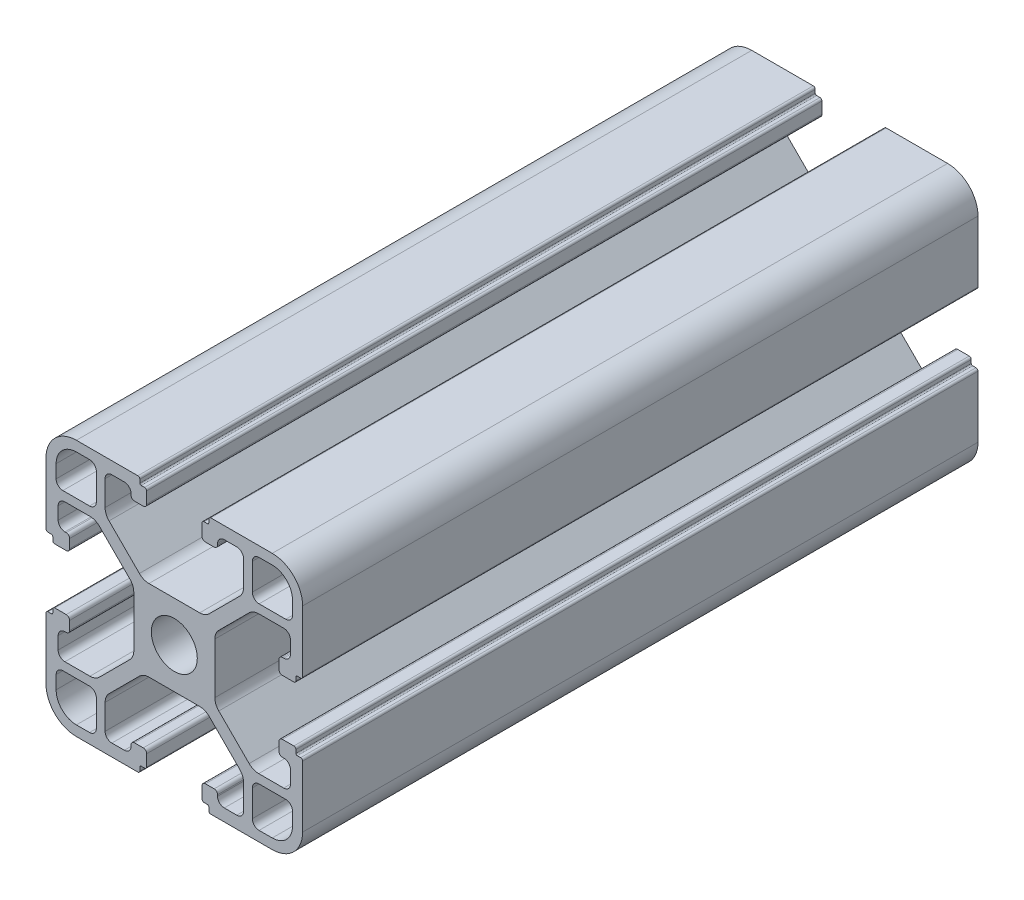
from build123d import *

# Parameters (mm, degrees)
SKETCH_1_R      = 3.4
EXTRUDE_1_DEPTH = 100


with BuildPart() as part:
    # 草图1 → 凸台-拉伸1 (new body)
    with BuildSketch(Plane.XY):
        with BuildLine():
            Line((-5.1, -18.7), (-5.1, -18.2))
            ThreePointArc((-5.1, -18.2), (-5.041421356, -18.058578644), (-4.9, -18))
            Line((-4.9, -18), (-4.4, -18))
            ThreePointArc((-4.4, -18), (-4.187867966, -17.912132034), (-4.1, -17.7))
            Line((-4.1, -17.7), (-4.1, -16))
            ThreePointArc((-4.1, -16), (-4.246446609, -15.646446609), (-4.6, -15.5))
            Line((-4.6, -15.5), (-5.9, -15.5))
            ThreePointArc((-5.9, -15.5), (-6.253553391, -15.646446609), (-6.4, -16))
            Line((-6.4, -16), (-6.4, -16.2))
            ThreePointArc((-6.4, -16.2), (-6.692893219, -16.907106781), (-7.4, -17.2))
            Line((-7.4, -17.2), (-9.25, -17.2))
            ThreePointArc((-9.25, -17.2), (-9.957106781, -16.907106781), (-10.25, -16.2))
            Line((-10.25, -16.2), (-10.25, -12.492640687))
            ThreePointArc((-10.25, -12.492640687), (-10.097759065, -11.727273822), (-9.664213562, -11.078427125))
            Line((-9.664213562, -11.078427125), (-5.171572875, -6.585786438))
            ThreePointArc((-5.171572875, -6.585786438), (-4.522726178, -6.152240935), (-3.757359313, -6))
            Line((-3.757359313, -6), (3.757359313, -6))
            ThreePointArc((3.757359313, -6), (4.522726178, -6.152240935), (5.171572875, -6.585786438))
            Line((5.171572875, -6.585786438), (9.664213562, -11.078427125))
            ThreePointArc((9.664213562, -11.078427125), (10.097759065, -11.727273822), (10.25, -12.492640687))
            Line((10.25, -12.492640687), (10.25, -16.2))
            ThreePointArc((10.25, -16.2), (9.957106781, -16.907106781), (9.25, -17.2))
            Line((9.25, -17.2), (7.4, -17.2))
            ThreePointArc((7.4, -17.2), (6.692893219, -16.907106781), (6.4, -16.2))
            Line((6.4, -16.2), (6.4, -16))
            ThreePointArc((6.4, -16), (6.253553391, -15.646446609), (5.9, -15.5))
            Line((5.9, -15.5), (4.6, -15.5))
            ThreePointArc((4.6, -15.5), (4.246446609, -15.646446609), (4.1, -16))
            Line((4.1, -16), (4.1, -17.7))
            ThreePointArc((4.1, -17.7), (4.187867966, -17.912132034), (4.4, -18))
            Line((4.4, -18), (4.9, -18))
            ThreePointArc((4.9, -18), (5.041421356, -18.058578644), (5.1, -18.2))
            Line((5.1, -18.2), (5.1, -18.7))
            ThreePointArc((5.1, -18.7), (5.187867966, -18.912132034), (5.4, -19))
            Line((5.4, -19), (14.5, -19))
            ThreePointArc((14.5, -19), (17.681980515, -17.681980515), (19, -14.5))
            Line((19, -14.5), (19, -5.4))
            ThreePointArc((19, -5.4), (18.912132034, -5.187867966), (18.7, -5.1))
            Line((18.7, -5.1), (18.2, -5.1))
            ThreePointArc((18.2, -5.1), (18.058578644, -5.041421356), (18, -4.9))
            Line((18, -4.9), (18, -4.4))
            ThreePointArc((18, -4.4), (17.912132034, -4.187867966), (17.7, -4.1))
            Line((17.7, -4.1), (16, -4.1))
            ThreePointArc((16, -4.1), (15.646446609, -4.246446609), (15.5, -4.6))
            Line((15.5, -4.6), (15.5, -5.9))
            ThreePointArc((15.5, -5.9), (15.646446609, -6.253553391), (16, -6.4))
            Line((16, -6.4), (16.2, -6.4))
            ThreePointArc((16.2, -6.4), (16.907106781, -6.692893219), (17.2, -7.4))
            Line((17.2, -7.4), (17.2, -9.25))
            ThreePointArc((17.2, -9.25), (16.907106781, -9.957106781), (16.2, -10.25))
            Line((16.2, -10.25), (12.492640687, -10.25))
            ThreePointArc((12.492640687, -10.25), (11.727273822, -10.097759065), (11.078427125, -9.664213562))
            Line((11.078427125, -9.664213562), (6.585786438, -5.171572875))
            ThreePointArc((6.585786438, -5.171572875), (6.152240935, -4.522726178), (6, -3.757359313))
            Line((6, -3.757359313), (6, 3.757359313))
            ThreePointArc((6, 3.757359313), (6.152240935, 4.522726178), (6.585786438, 5.171572875))
            Line((6.585786438, 5.171572875), (11.078427125, 9.664213562))
            ThreePointArc((11.078427125, 9.664213562), (11.727273822, 10.097759065), (12.492640687, 10.25))
            Line((12.492640687, 10.25), (16.2, 10.25))
            ThreePointArc((16.2, 10.25), (16.907106781, 9.957106781), (17.2, 9.25))
            Line((17.2, 9.25), (17.2, 7.4))
            ThreePointArc((17.2, 7.4), (16.907106781, 6.692893219), (16.2, 6.4))
            Line((16.2, 6.4), (16, 6.4))
            ThreePointArc((16, 6.4), (15.646446609, 6.253553391), (15.5, 5.9))
            Line((15.5, 5.9), (15.5, 4.6))
            ThreePointArc((15.5, 4.6), (15.646446609, 4.246446609), (16, 4.1))
            Line((16, 4.1), (17.7, 4.1))
            ThreePointArc((17.7, 4.1), (17.912132034, 4.187867966), (18, 4.4))
            Line((18, 4.4), (18, 4.9))
            ThreePointArc((18, 4.9), (18.058578644, 5.041421356), (18.2, 5.1))
            Line((18.2, 5.1), (18.7, 5.1))
            ThreePointArc((18.7, 5.1), (18.912132034, 5.187867966), (19, 5.4))
            Line((19, 5.4), (19, 14.5))
            ThreePointArc((19, 14.5), (17.681980515, 17.681980515), (14.5, 19))
            Line((14.5, 19), (5.4, 19))
            ThreePointArc((5.4, 19), (5.187867966, 18.912132034), (5.1, 18.7))
            Line((5.1, 18.7), (5.1, 18.2))
            ThreePointArc((5.1, 18.2), (5.041421356, 18.058578644), (4.9, 18))
            Line((4.9, 18), (4.4, 18))
            ThreePointArc((4.4, 18), (4.187867966, 17.912132034), (4.1, 17.7))
            Line((4.1, 17.7), (4.1, 16))
            ThreePointArc((4.1, 16), (4.246446609, 15.646446609), (4.6, 15.5))
            Line((4.6, 15.5), (5.9, 15.5))
            ThreePointArc((5.9, 15.5), (6.253553391, 15.646446609), (6.4, 16))
            Line((6.4, 16), (6.4, 16.2))
            ThreePointArc((6.4, 16.2), (6.692893219, 16.907106781), (7.4, 17.2))
            Line((7.4, 17.2), (9.25, 17.2))
            ThreePointArc((9.25, 17.2), (9.957106781, 16.907106781), (10.25, 16.2))
            Line((10.25, 16.2), (10.25, 12.492640687))
            ThreePointArc((10.25, 12.492640687), (10.097759065, 11.727273822), (9.664213562, 11.078427125))
            Line((9.664213562, 11.078427125), (5.171572875, 6.585786438))
            ThreePointArc((5.171572875, 6.585786438), (4.522726178, 6.152240935), (3.757359313, 6))
            Line((3.757359313, 6), (-3.757359313, 6))
            ThreePointArc((-3.757359313, 6), (-4.522726178, 6.152240935), (-5.171572875, 6.585786438))
            Line((-5.171572875, 6.585786438), (-9.664213562, 11.078427125))
            ThreePointArc((-9.664213562, 11.078427125), (-10.097759065, 11.727273822), (-10.25, 12.492640687))
            Line((-10.25, 12.492640687), (-10.25, 16.2))
            ThreePointArc((-10.25, 16.2), (-9.957106781, 16.907106781), (-9.25, 17.2))
            Line((-9.25, 17.2), (-7.4, 17.2))
            ThreePointArc((-7.4, 17.2), (-6.692893219, 16.907106781), (-6.4, 16.2))
            Line((-6.4, 16.2), (-6.4, 16))
            ThreePointArc((-6.4, 16), (-6.253553391, 15.646446609), (-5.9, 15.5))
            Line((-5.9, 15.5), (-4.6, 15.5))
            ThreePointArc((-4.6, 15.5), (-4.246446609, 15.646446609), (-4.1, 16))
            Line((-4.1, 16), (-4.1, 17.7))
            ThreePointArc((-4.1, 17.7), (-4.187867966, 17.912132034), (-4.4, 18))
            Line((-4.4, 18), (-4.9, 18))
            ThreePointArc((-4.9, 18), (-5.041421356, 18.058578644), (-5.1, 18.2))
            Line((-5.1, 18.2), (-5.1, 18.7))
            ThreePointArc((-5.1, 18.7), (-5.187867966, 18.912132034), (-5.4, 19))
            Line((-5.4, 19), (-14.5, 19))
            ThreePointArc((-14.5, 19), (-17.681980515, 17.681980515), (-19, 14.5))
            Line((-19, 14.5), (-19, 5.4))
            ThreePointArc((-19, 5.4), (-18.912132034, 5.187867966), (-18.7, 5.1))
            Line((-18.7, 5.1), (-18.2, 5.1))
            ThreePointArc((-18.2, 5.1), (-18.058578644, 5.041421356), (-18, 4.9))
            Line((-18, 4.9), (-18, 4.4))
            ThreePointArc((-18, 4.4), (-17.912132034, 4.187867966), (-17.7, 4.1))
            Line((-17.7, 4.1), (-16, 4.1))
            ThreePointArc((-16, 4.1), (-15.646446609, 4.246446609), (-15.5, 4.6))
            Line((-15.5, 4.6), (-15.5, 5.9))
            ThreePointArc((-15.5, 5.9), (-15.646446609, 6.253553391), (-16, 6.4))
            Line((-16, 6.4), (-16.2, 6.4))
            ThreePointArc((-16.2, 6.4), (-16.907106781, 6.692893219), (-17.2, 7.4))
            Line((-17.2, 7.4), (-17.2, 9.25))
            ThreePointArc((-17.2, 9.25), (-16.907106781, 9.957106781), (-16.2, 10.25))
            Line((-16.2, 10.25), (-12.492640687, 10.25))
            ThreePointArc((-12.492640687, 10.25), (-11.727273822, 10.097759065), (-11.078427125, 9.664213562))
            Line((-11.078427125, 9.664213562), (-6.585786438, 5.171572875))
            ThreePointArc((-6.585786438, 5.171572875), (-6.152240935, 4.522726178), (-6, 3.757359313))
            Line((-6, 3.757359313), (-6, -3.757359313))
            ThreePointArc((-6, -3.757359313), (-6.152240935, -4.522726178), (-6.585786438, -5.171572875))
            Line((-6.585786438, -5.171572875), (-11.078427125, -9.664213562))
            ThreePointArc((-11.078427125, -9.664213562), (-11.727273822, -10.097759065), (-12.492640687, -10.25))
            Line((-12.492640687, -10.25), (-16.2, -10.25))
            ThreePointArc((-16.2, -10.25), (-16.907106781, -9.957106781), (-17.2, -9.25))
            Line((-17.2, -9.25), (-17.2, -7.4))
            ThreePointArc((-17.2, -7.4), (-16.907106781, -6.692893219), (-16.2, -6.4))
            Line((-16.2, -6.4), (-16, -6.4))
            ThreePointArc((-16, -6.4), (-15.646446609, -6.253553391), (-15.5, -5.9))
            Line((-15.5, -5.9), (-15.5, -4.6))
            ThreePointArc((-15.5, -4.6), (-15.646446609, -4.246446609), (-16, -4.1))
            Line((-16, -4.1), (-17.7, -4.1))
            ThreePointArc((-17.7, -4.1), (-17.912132034, -4.187867966), (-18, -4.4))
            Line((-18, -4.4), (-18, -4.9))
            ThreePointArc((-18, -4.9), (-18.058578644, -5.041421356), (-18.2, -5.1))
            Line((-18.2, -5.1), (-18.7, -5.1))
            ThreePointArc((-18.7, -5.1), (-18.912132034, -5.187867966), (-19, -5.4))
            Line((-19, -5.4), (-19, -14.5))
            ThreePointArc((-19, -14.5), (-17.681980515, -17.681980515), (-14.5, -19))
            Line((-14.5, -19), (-5.4, -19))
            ThreePointArc((-5.4, -19), (-5.187867966, -18.912132034), (-5.1, -18.7))
        make_face()
        Circle(SKETCH_1_R, mode=Mode.SUBTRACT)
        with BuildLine():
            Line((-14.5, -17.5), (-12.55, -17.5))
            ThreePointArc((-12.55, -17.5), (-11.842893219, -17.207106781), (-11.55, -16.5))
            Line((-11.55, -16.5), (-11.55, -12.55))
            ThreePointArc((-11.55, -12.55), (-11.842893219, -11.842893219), (-12.55, -11.55))
            Line((-12.55, -11.55), (-16.5, -11.55))
            ThreePointArc((-16.5, -11.55), (-17.207106781, -11.842893219), (-17.5, -12.55))
            Line((-17.5, -12.55), (-17.5, -14.5))
            ThreePointArc((-17.5, -14.5), (-16.621320344, -16.621320344), (-14.5, -17.5))
        make_face(mode=Mode.SUBTRACT)
        with BuildLine():
            Line((-12.55, 17.5), (-14.5, 17.5))
            ThreePointArc((-14.5, 17.5), (-16.621320344, 16.621320344), (-17.5, 14.5))
            Line((-17.5, 14.5), (-17.5, 12.55))
            ThreePointArc((-17.5, 12.55), (-17.207106781, 11.842893219), (-16.5, 11.55))
            Line((-16.5, 11.55), (-12.55, 11.55))
            ThreePointArc((-12.55, 11.55), (-11.842893219, 11.842893219), (-11.55, 12.55))
            Line((-11.55, 12.55), (-11.55, 16.5))
            ThreePointArc((-11.55, 16.5), (-11.842893219, 17.207106781), (-12.55, 17.5))
        make_face(mode=Mode.SUBTRACT)
        with BuildLine():
            Line((12.55, 11.55), (16.5, 11.55))
            ThreePointArc((16.5, 11.55), (17.207106781, 11.842893219), (17.5, 12.55))
            Line((17.5, 12.55), (17.5, 14.5))
            ThreePointArc((17.5, 14.5), (16.621320344, 16.621320344), (14.5, 17.5))
            Line((14.5, 17.5), (12.55, 17.5))
            ThreePointArc((12.55, 17.5), (11.842893219, 17.207106781), (11.55, 16.5))
            Line((11.55, 16.5), (11.55, 12.55))
            ThreePointArc((11.55, 12.55), (11.842893219, 11.842893219), (12.55, 11.55))
        make_face(mode=Mode.SUBTRACT)
        with BuildLine():
            Line((12.55, -17.5), (14.5, -17.5))
            ThreePointArc((14.5, -17.5), (16.621320344, -16.621320344), (17.5, -14.5))
            Line((17.5, -14.5), (17.5, -12.55))
            ThreePointArc((17.5, -12.55), (17.207106781, -11.842893219), (16.5, -11.55))
            Line((16.5, -11.55), (12.55, -11.55))
            ThreePointArc((12.55, -11.55), (11.842893219, -11.842893219), (11.55, -12.55))
            Line((11.55, -12.55), (11.55, -16.5))
            ThreePointArc((11.55, -16.5), (11.842893219, -17.207106781), (12.55, -17.5))
        make_face(mode=Mode.SUBTRACT)
    extrude(amount=EXTRUDE_1_DEPTH)


solid = part.part
